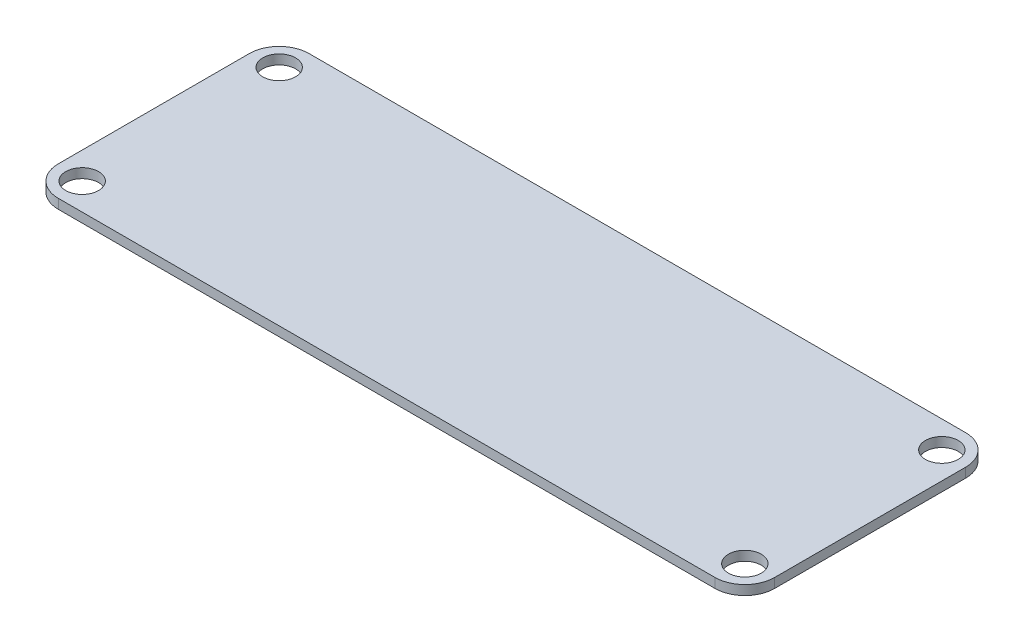
from build123d import *

# Parameters (mm, degrees)
AUFSATZ_LINEAR_AUSTRAGEN1_DEPTH = 1.6
SKIZZE2_R                       = 2.75
SCHNITT_LINEAR_AUSTRAGEN1_DEPTH = 64.588992758


with BuildPart() as part:
    # Skizze1 → Aufsatz-Linear austragen1 (new body)
    with BuildSketch(Plane(origin=(0, 0, 0), x_dir=(1, 0, 0), z_dir=(0, 1, 0))):
        with BuildLine():
            Line((-55, 21), (55, 21))
            ThreePointArc((55, 21), (58.535533906, 19.535533906), (60, 16))
            Line((60, 16), (60, -16))
            ThreePointArc((60, -16), (58.535533906, -19.535533906), (55, -21))
            Line((55, -21), (-55, -21))
            ThreePointArc((-55, -21), (-58.535533906, -19.535533906), (-60, -16))
            Line((-60, -16), (-60, 16))
            ThreePointArc((-60, 16), (-58.535533906, 19.535533906), (-55, 21))
        make_face()
    extrude(amount=AUFSATZ_LINEAR_AUSTRAGEN1_DEPTH)

    # Skizze2 → Schnitt-Linear austragen1 (cut, through all)
    with BuildSketch(Plane(origin=(0, 1.6, 0), x_dir=(1, 0, 0), z_dir=(0, 1, 0))):
        with Locations(Location((-55.5, 16.5, 0), (0, 0, 270))):
            Circle(SKIZZE2_R)
        with Locations(Location((-55.5, -16.5, 0), (0, 0, 270))):
            Circle(SKIZZE2_R)
        with Locations(Location((55.5, 16.5, 0), (0, 0, 270))):
            Circle(SKIZZE2_R)
        with Locations(Location((55.5, -16.5, 0), (0, 0, 270))):
            Circle(SKIZZE2_R)
    extrude(amount=-SCHNITT_LINEAR_AUSTRAGEN1_DEPTH, mode=Mode.SUBTRACT)


solid = part.part
